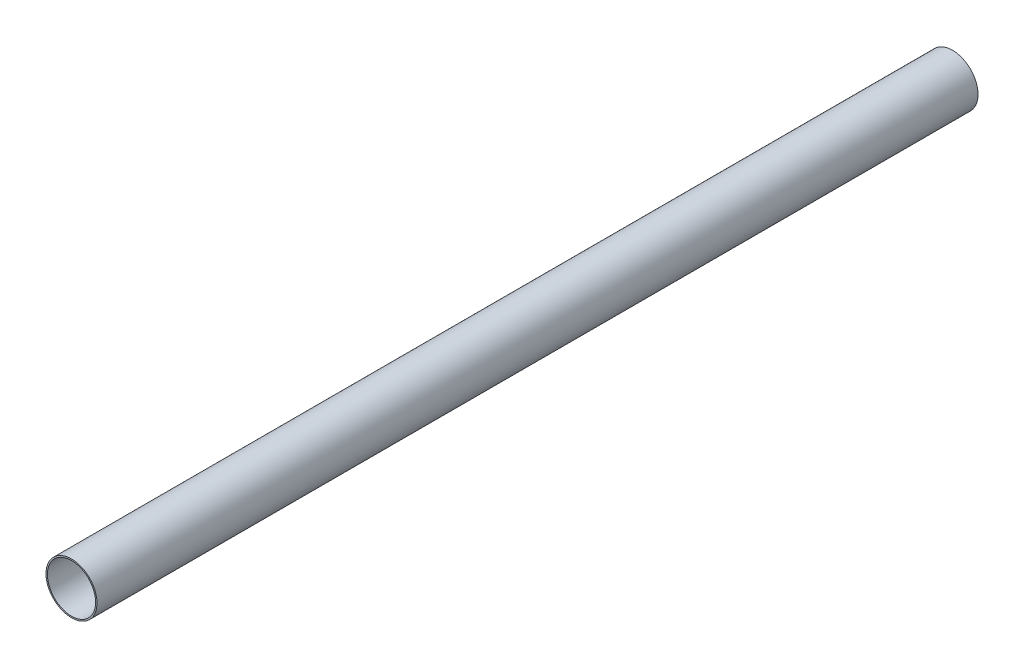
from build123d import *

# Parameters (mm, degrees)
SKIZZE1_R                       = 55
AUFSATZ_LINEAR_AUSTRAGEN2_DEPTH = 1900
WANDUNG2_T                      = -3


with BuildPart() as part:
    # Skizze1 → Aufsatz-Linear austragen2 (new body)
    with BuildSketch(Plane.XY):
        Circle(SKIZZE1_R)
    extrude(amount=AUFSATZ_LINEAR_AUSTRAGEN2_DEPTH)

    # Wandung2
    wandung2_openings = [part.faces().sort_by_distance(p)[0] for p in [
        (0, 0, 0),
        (0, 0, 1900),
    ]]
    offset(amount=WANDUNG2_T, openings=wandung2_openings, kind=Kind.INTERSECTION)


solid = part.part
